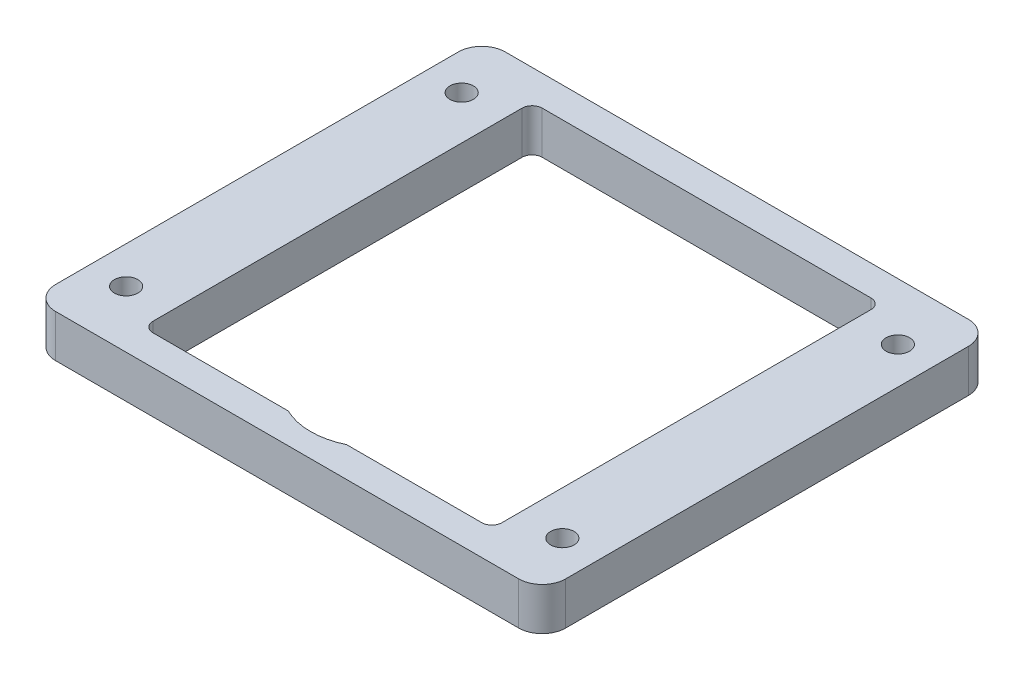
from build123d import *

# Parameters (mm, degrees)
BOSS_EXTRUDE1_DEPTH         = 6.35
TAP_DRILL_FOR_M5X0_8_TAP1_D = 3.5
SKETCH4_R                   = 10
CUT_EXTRUDE1_DEPTH          = 52.054603123


with BuildPart() as part:
    # Sketch1 → Boss-Extrude1 (new body)
    with BuildSketch(Plane(origin=(0, 0, 0), x_dir=(1, 0, 0), z_dir=(0, 1, 0))):
        with BuildLine():
            Line((34.5, -33.5), (-34.5, -33.5))
            ThreePointArc((-34.5, -33.5), (-36.974873734, -32.474873734), (-38, -30))
            Line((-38, -30), (-38, 30))
            ThreePointArc((-38, 30), (-36.974873734, 32.474873734), (-34.5, 33.5))
            Line((-34.5, 33.5), (34.5, 33.5))
            ThreePointArc((34.5, 33.5), (36.974873734, 32.474873734), (38, 30))
            Line((38, 30), (38, -30))
            ThreePointArc((38, -30), (36.974873734, -32.474873734), (34.5, -33.5))
        make_face()
        with BuildLine():
            Line((24.5, -29), (-24.5, -29))
            ThreePointArc((-24.5, -29), (-25.560660172, -28.560660172), (-26, -27.5))
            Line((-26, -27.5), (-26, 27.5))
            ThreePointArc((-26, 27.5), (-25.560660172, 28.560660172), (-24.5, 29))
            Line((-24.5, 29), (24.5, 29))
            ThreePointArc((24.5, 29), (25.560660172, 28.560660172), (26, 27.5))
            Line((26, 27.5), (26, -27.5))
            ThreePointArc((26, -27.5), (25.560660172, -28.560660172), (24.5, -29))
        make_face(mode=Mode.SUBTRACT)
    extrude(amount=BOSS_EXTRUDE1_DEPTH)

    # Tap Drill for M5x0.8 Tap1 (through all)
    with Locations(Plane(origin=(0, 6.35, 0), x_dir=(1, 0, 0), z_dir=(0, 1, 0))):
        with Locations((-32.5, -25), (-32.5, 25), (32.5, -25), (32.5, 25)):
            Hole(TAP_DRILL_FOR_M5X0_8_TAP1_D / 2)

    # Sketch4 → Cut-Extrude1 (cut, through all)
    with BuildSketch(Plane(origin=(0, 6.35, 0), x_dir=(1, 0, 0), z_dir=(0, 1, 0))):
        with Locations((0, -20)):
            Circle(SKETCH4_R)
    extrude(amount=-CUT_EXTRUDE1_DEPTH, mode=Mode.SUBTRACT)


solid = part.part
